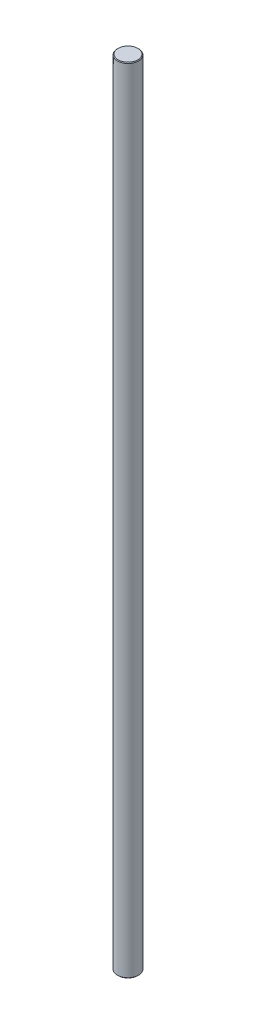
from build123d import *

# Parameters (mm, degrees)
SZKIC1_R                    = 4
DODANIE_WYCI_GNI_CIE1_DEPTH = 300
SFAZOWANIE1_SIZE            = 0.25


with BuildPart() as part:
    # Szkic1 → Dodanie-wyciągnięcie1 (new body)
    with BuildSketch(Plane(origin=(0, 0, 0), x_dir=(1, 0, 0), z_dir=(0, 1, 0))):
        with Locations(Location((-19.421806723, 6.007592757, 0), (0, 0, 270))):
            Circle(SZKIC1_R)
    extrude(amount=DODANIE_WYCI_GNI_CIE1_DEPTH)

    # Sfazowanie1
    sfazowanie1_edges = [part.edges().sort_by_distance(p)[0] for p in [
        (-19.421806723, 0, -10.007592757),
        (-19.421806723, 300, -10.007592757),
    ]]
    chamfer(sfazowanie1_edges, length=SFAZOWANIE1_SIZE)


solid = part.part
